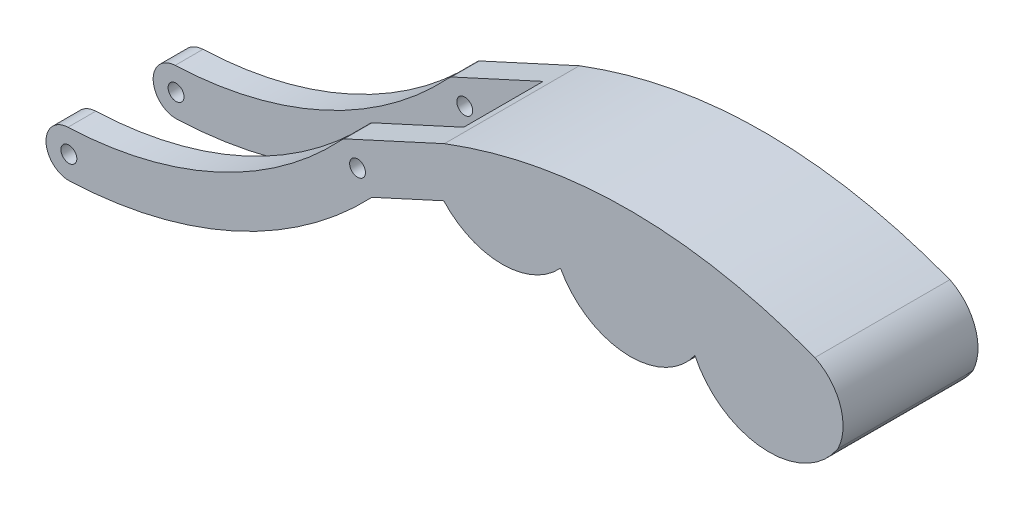
from build123d import *

# Parameters (mm, degrees)
CROQUIS1_R                 = 3
SALIENTE_EXTRUIR1_DEPTH    = 51
CORTAR_EXTRUIR1_DEPTH      = 311.888957589
CORTAR_EXTRUIR1_DEPTH_BACK = 311.888957589
CROQUIS2_W                 = 330
CROQUIS2_H                 = 30


with BuildPart() as part:
    # Croquis1 → Saliente-Extruir1 (new body)
    # profile 1 of 4: a face of its own
    with BuildSketch(Plane.XY):
        with BuildLine():
            Line((141.907724078, 74.393898239), (106.994802629, 58.391586929))
            ThreePointArc((106.994802629, 58.391586929), (116.540266028, 54.387158459), (115.408572004, 44.097815064))
            ThreePointArc((115.408572004, 44.097815064), (114.953536771, 43.612404014), (114.496565447, 43.128815181))
            Line((114.496565447, 43.128815181), (141.660745717, 55.579496794))
            ThreePointArc((141.660745717, 55.579496794), (163.715018222, 45.838294791), (185.769290727, 55.579496794))
            ThreePointArc((185.769290727, 55.579496794), (210.289811625, 39.891989826), (236.56917478, 52.411929606))
            ThreePointArc((236.56917478, 52.411929606), (262.563049751, 34.849044969), (290.598242925, 48.926132611))
            ThreePointArc((290.598242925, 48.926132611), (291.527530464, 63.45988081), (281.907724078, 74.393898239))
            add(Edge.make_bspline(
                [(141.907724078, 74.393898239), (211.705167047, 100.839206128), (281.907724078, 74.393898239)],
                knots=[0, 0, 0, 1, 1, 1], degree=2))
        make_face()
    # profile 2 of 4: a face of its own
    with BuildSketch(Plane.XY):
        with BuildLine():
            ThreePointArc((105.545350362, 57.727231572), (116.814352718, 53.541770784), (112.62889193, 42.272768428))
            Line((112.62889193, 42.272768428), (114.496565447, 43.128815181))
            ThreePointArc((114.496565447, 43.128815181), (114.953536771, 43.612404014), (115.408572004, 44.097815064))
            ThreePointArc((115.408572004, 44.097815064), (116.540266028, 54.387158459), (106.994802629, 58.391586929))
            Line((106.994802629, 58.391586929), (105.545350362, 57.727231572))
        make_face()
    # profile 3 of 4: a face of its own
    with BuildSketch(Plane.XY):
        with BuildLine():
            Line((-2.092318518, 8.391586929), (-3.541770784, 7.727231572))
            ThreePointArc((-3.541770784, 7.727231572), (-7.727231572, -3.541770784), (3.541770784, -7.727231572))
            Line((3.541770784, -7.727231572), (112.62889193, 42.272768428))
            ThreePointArc((112.62889193, 42.272768428), (116.814352718, 53.541770784), (105.545350362, 57.727231572))
            Line((105.545350362, 57.727231572), (104.095898096, 57.062876215))
            ThreePointArc((104.095898096, 57.062876215), (103.401090123, 56.516561913), (102.765670289, 55.902184936))
            ThreePointArc((102.765670289, 55.902184936), (55.876581472, 22.091691755), (-0.344694323, 8.641626802))
            ThreePointArc((-0.344694323, 8.641626802), (-1.224903213, 8.561316493), (-2.092318518, 8.391586929))
        make_face()
        Circle(CROQUIS1_R, mode=Mode.SUBTRACT)
        with Locations((109.087121146, 50)):
            Circle(CROQUIS1_R, mode=Mode.SUBTRACT)
    # profile 4 of 4: a face of its own
    with BuildSketch(Plane.XY):
        with BuildLine():
            ThreePointArc((3.541770784, -7.727231572), (-7.727231572, -3.541770784), (-3.541770784, 7.727231572))
            Line((-3.541770784, 7.727231572), (-2.092318518, 8.391586929))
            ThreePointArc((-2.092318518, 8.391586929), (-8.561316493, -1.224903213), (0.344694323, -8.641626802))
            ThreePointArc((0.344694323, -8.641626802), (62.478274911, 6.091677747), (114.496565447, 43.128815181))
            Line((114.496565447, 43.128815181), (112.62889193, 42.272768428))
            Line((112.62889193, 42.272768428), (3.541770784, -7.727231572))
        make_face()
    extrude(amount=SALIENTE_EXTRUIR1_DEPTH)

    # Croquis2 → Cortar-Extruir1 (cut, two sides: drawn at the far end of the back side and taken through both)
    with BuildSketch(Plane(origin=(-3.541770784, 7.727231572, 0), x_dir=(0.9090593428863096, 0.4166666666666667, 0), z_dir=(-0.41666666666666663, 0.9090593428863095, 0)).offset(-CORTAR_EXTRUIR1_DEPTH_BACK)):
        with Locations((-8.500249882, -25.5)):
            Rectangle(CROQUIS2_W, CROQUIS2_H)
    extrude(amount=CORTAR_EXTRUIR1_DEPTH + CORTAR_EXTRUIR1_DEPTH_BACK, mode=Mode.SUBTRACT)


solid = part.part
